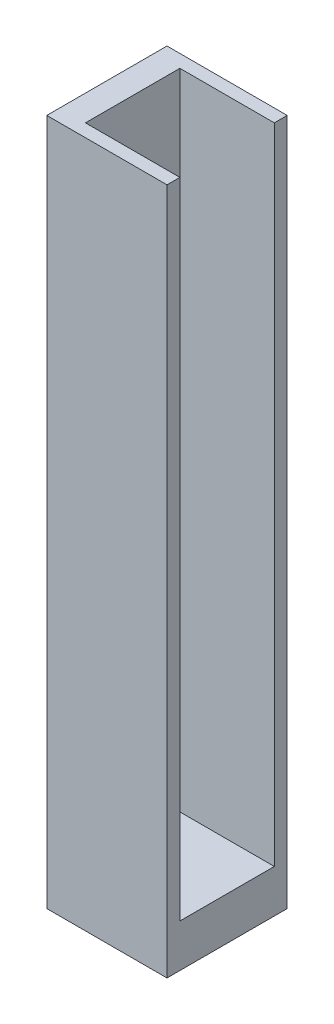
from build123d import *

# Parameters (mm, degrees)
ESQUISSE1_W             = 14
ESQUISSE1_H             = 14
BOSS_EXTRU_1_DEPTH      = 80
ESQUISSE2_W             = 11
ESQUISSE2_H             = 11
ENL_V_MAT_EXTRU_1_DEPTH = 75


with BuildPart() as part:
    # Esquisse1 → Boss.-Extru.1 (new body)
    with BuildSketch(Plane(origin=(0, 0, 0), x_dir=(1, 0, 0), z_dir=(0, 1, 0))):
        with Locations((-47.752969121, 49.127078385)):
            Rectangle(ESQUISSE1_W, ESQUISSE1_H)
    extrude(amount=BOSS_EXTRU_1_DEPTH)

    # Esquisse2 → Enlèv. mat.-Extru.1 (cut)
    with BuildSketch(Plane(origin=(0, 80, 0), x_dir=(1, 0, 0), z_dir=(0, 1, 0))):
        with Locations((-46.252969121, 49.127078385)):
            Rectangle(ESQUISSE2_W, ESQUISSE2_H)
    extrude(amount=-ENL_V_MAT_EXTRU_1_DEPTH, mode=Mode.SUBTRACT)


solid = part.part
